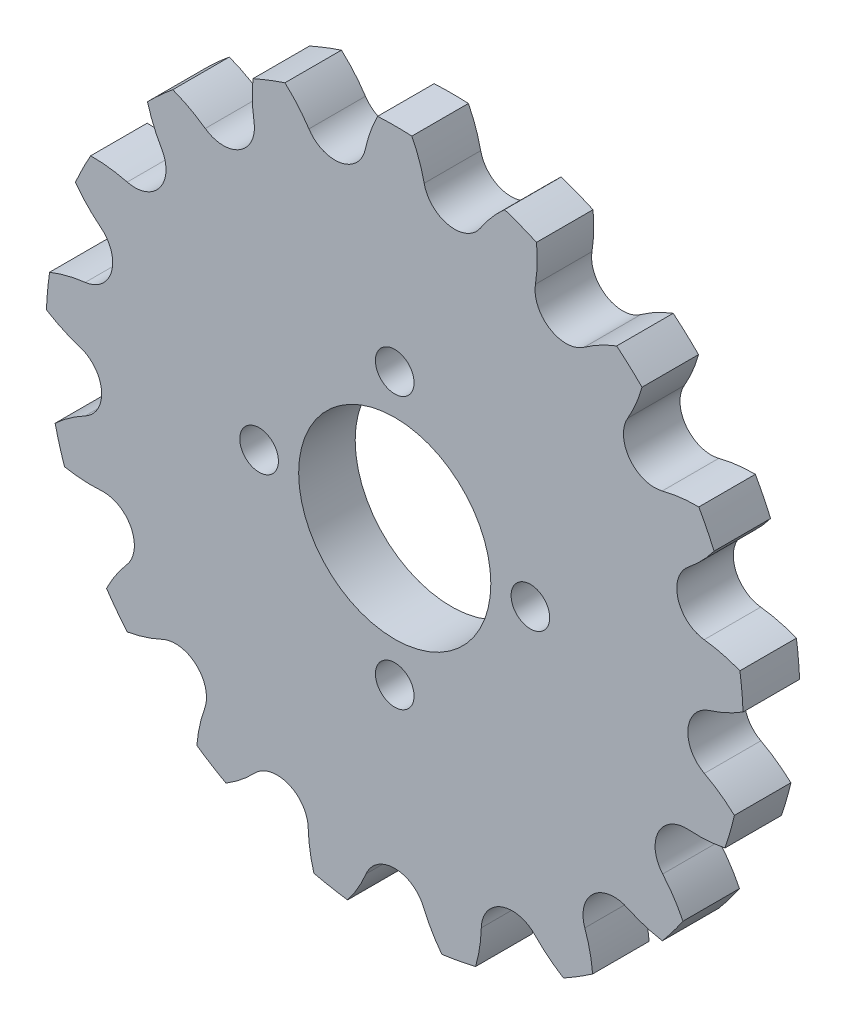
from build123d import *

# Parameters (mm, degrees)
EXTRUDE_2_DEPTH      = 3
HOLE_WIZARD_M2_5_1_D = 2.05
SKETCH_4_R           = 5.1
CUT_EXTRUDE_1_DEPTH  = 10


with BuildPart() as part:
    # 草图1 → 凸台-拉伸2 (new body)
    with BuildSketch(Plane.XY):
        with BuildLine():
            ThreePointArc((-11.779760181, 14.271379579), (-12.466737886, 13.675360013), (-13.123601243, 13.046306581))
            ThreePointArc((-13.123601243, 13.046306581), (-12.803108373, 12.120767872), (-12.365117817, 11.24469604))
            ThreePointArc((-12.365117817, 11.24469604), (-12.142820781, 10.31561124), (-12.473009262, 9.419179367))
            ThreePointArc((-12.473009262, 9.419179367), (-13.244860059, 8.856275392), (-14.199312115, 8.815830257))
            ThreePointArc((-14.199312115, 8.815830257), (-15.161802274, 8.997352368), (-16.139716175, 9.052324938))
            ThreePointArc((-16.139716175, 9.052324938), (-16.564996707, 8.248388274), (-16.950263236, 7.424527004))
            ThreePointArc((-16.950263236, 7.424527004), (-16.317069389, 6.677263239), (-15.592181711, 6.018571022))
            ThreePointArc((-15.592181711, 6.018571022), (-15.049271757, 5.2325282), (-15.033334803, 4.277352535))
            ThreePointArc((-15.033334803, 4.277352535), (-15.549719866, 3.473635543), (-16.425109435, 3.091133726))
            ThreePointArc((-16.425109435, 3.091133726), (-17.388178129, 2.912706505), (-18.319914067, 2.610703653))
            ThreePointArc((-18.319914067, 2.610703653), (-18.426060932, 1.707425992), (-18.487698254, 0.800023914))
            ThreePointArc((-18.487698254, 0.800023914), (-17.627319769, 0.331957205), (-16.713435066, -0.020395362))
            ThreePointArc((-16.713435066, -0.020395362), (-15.923235192, -0.557236769), (-15.563325175, -1.442154458))
            ThreePointArc((-15.563325175, -1.442154458), (-15.754503841, -2.378138035), (-16.432604711, -3.051037542))
            ThreePointArc((-16.432604711, -3.051037542), (-17.266184176, -3.565316511), (-18.02590605, -4.183507626))
            ThreePointArc((-18.02590605, -4.183507626), (-17.798583527, -5.064133631), (-17.528267179, -5.932526839))
            ThreePointArc((-17.528267179, -5.932526839), (-16.556902937, -6.058181489), (-15.577446402, -6.056607239))
            ThreePointArc((-15.577446402, -6.056607239), (-14.64667748, -6.271743824), (-13.991402244, -6.966890501))
            ThreePointArc((-13.991402244, -6.966890501), (-13.831554774, -7.908730892), (-14.220785664, -8.781149285))
            ThreePointArc((-14.220785664, -8.781149285), (-14.812296375, -9.561823776), (-15.297399536, -10.412713019))
            ThreePointArc((-15.297399536, -10.412713019), (-14.767308791, -11.151753946), (-14.201546494, -11.863856968))
            ThreePointArc((-14.201546494, -11.863856968), (-13.250384619, -11.630129203), (-12.337637284, -11.274840748))
            ThreePointArc((-12.337637284, -11.274840748), (-11.392004814, -11.139217123), (-10.52986291, -11.550709376))
            ThreePointArc((-10.52986291, -11.550709376), (-10.040577591, -12.371205819), (-10.088370713, -13.325318158))
            ThreePointArc((-10.088370713, -13.325318158), (-10.357925871, -14.266953756), (-10.502894449, -15.23562382))
            ThreePointArc((-10.502894449, -15.23562382), (-9.741627174, -15.733268097), (-8.956828262, -16.192907475))
            ThreePointArc((-8.956828262, -16.192907475), (-8.154328435, -15.631363523), (-7.431561886, -14.970344538))
            ThreePointArc((-7.431561886, -14.970344538), (-6.598778773, -14.502277424), (-5.646207243, -14.574540946))
            ThreePointArc((-5.646207243, -14.574540946), (-4.893564768, -15.162880849), (-4.593465396, -16.069828976))
            ThreePointArc((-4.593465396, -16.069828976), (-4.504660083, -17.045252575), (-4.289915268, -18.000879201))
            ThreePointArc((-4.289915268, -18.000879201), (-3.400284827, -18.18991721), (-2.502440741, -18.335016099))
            ThreePointArc((-2.502440741, -18.335016099), (-1.956985011, -17.521495584), (-1.521812876, -16.644020345))
            ThreePointArc((-1.521812876, -16.644020345), (-0.914351093, -15.9067248), (0, -15.63))
            ThreePointArc((0, -15.63), (0.914351093, -15.9067248), (1.521812876, -16.644020345))
            ThreePointArc((1.521812876, -16.644020345), (1.956985011, -17.521495584), (2.502440741, -18.335016099))
            ThreePointArc((2.502440741, -18.335016099), (3.400284827, -18.18991721), (4.289915268, -18.000879201))
            ThreePointArc((4.289915268, -18.000879201), (4.504660083, -17.045252575), (4.593465396, -16.069828976))
            ThreePointArc((4.593465396, -16.069828976), (4.893564768, -15.162880849), (5.646207243, -14.574540946))
            ThreePointArc((5.646207243, -14.574540946), (6.598778773, -14.502277424), (7.431561886, -14.970344538))
            ThreePointArc((7.431561886, -14.970344538), (8.154328435, -15.631363523), (8.956828262, -16.192907475))
            ThreePointArc((8.956828262, -16.192907475), (9.741627174, -15.733268097), (10.502894449, -15.23562382))
            ThreePointArc((10.502894449, -15.23562382), (10.357925871, -14.266953756), (10.088370713, -13.325318158))
            ThreePointArc((10.088370713, -13.325318158), (10.040577591, -12.371205819), (10.52986291, -11.550709376))
            ThreePointArc((10.52986291, -11.550709376), (11.392004814, -11.139217123), (12.337637284, -11.274840748))
            ThreePointArc((12.337637284, -11.274840748), (13.250384619, -11.630129203), (14.201546494, -11.863856968))
            ThreePointArc((14.201546494, -11.863856968), (14.767308791, -11.151753946), (15.297399536, -10.412713019))
            ThreePointArc((15.297399536, -10.412713019), (14.812296375, -9.561823776), (14.220785664, -8.781149285))
            ThreePointArc((14.220785664, -8.781149285), (13.831554774, -7.908730892), (13.991402244, -6.966890501))
            ThreePointArc((13.991402244, -6.966890501), (14.64667748, -6.271743824), (15.577446402, -6.056607239))
            ThreePointArc((15.577446402, -6.056607239), (16.556902937, -6.058181489), (17.528267179, -5.932526839))
            ThreePointArc((17.528267179, -5.932526839), (17.798583527, -5.064133631), (18.02590605, -4.183507626))
            ThreePointArc((18.02590605, -4.183507626), (17.266184176, -3.565316511), (16.432604711, -3.051037542))
            ThreePointArc((16.432604711, -3.051037542), (15.754503841, -2.378138035), (15.563325175, -1.442154458))
            ThreePointArc((15.563325175, -1.442154458), (15.923235192, -0.557236769), (16.713435066, -0.020395362))
            ThreePointArc((16.713435066, -0.020395362), (17.627319769, 0.331957205), (18.487698254, 0.800023914))
            ThreePointArc((18.487698254, 0.800023914), (18.426060932, 1.707425992), (18.319914067, 2.610703653))
            ThreePointArc((18.319914067, 2.610703653), (17.388178129, 2.912706505), (16.425109435, 3.091133726))
            ThreePointArc((16.425109435, 3.091133726), (15.549719866, 3.473635543), (15.033334803, 4.277352535))
            ThreePointArc((15.033334803, 4.277352535), (15.049271757, 5.2325282), (15.592181711, 6.018571022))
            ThreePointArc((15.592181711, 6.018571022), (16.317069389, 6.677263239), (16.950263236, 7.424527004))
            ThreePointArc((16.950263236, 7.424527004), (16.564996707, 8.248388274), (16.139716175, 9.052324938))
            ThreePointArc((16.139716175, 9.052324938), (15.161802274, 8.997352368), (14.199312115, 8.815830257))
            ThreePointArc((14.199312115, 8.815830257), (13.244860059, 8.856275392), (12.473009262, 9.419179367))
            ThreePointArc((12.473009262, 9.419179367), (12.142820781, 10.31561124), (12.365117817, 11.24469604))
            ThreePointArc((12.365117817, 11.24469604), (12.803108373, 12.120767872), (13.123601243, 13.046306581))
            ThreePointArc((13.123601243, 13.046306581), (12.466737886, 13.675360013), (11.779760181, 14.271379579))
            ThreePointArc((11.779760181, 14.271379579), (10.887741008, 13.866855937), (10.055819013, 13.349900061))
            ThreePointArc((10.055819013, 13.349900061), (9.151208508, 13.042826175), (8.228134706, 13.288893831))
            ThreePointArc((8.228134706, 13.288893831), (7.596414573, 14.005513822), (7.468076245, 14.952162548))
            ThreePointArc((7.468076245, 14.952162548), (7.560016626, 15.927295641), (7.524524182, 16.906110163))
            ThreePointArc((7.524524182, 16.906110163), (6.684777033, 17.255398605), (5.8288823, 17.563005328))
            ThreePointArc((5.8288823, 17.563005328), (5.143229987, 16.863563773), (4.554231832, 16.080991887))
            ThreePointArc((4.554231832, 16.080991887), (3.821635541, 15.46787101), (2.872004963, 15.363869548))
            ThreePointArc((2.872004963, 15.363869548), (2.024070484, 15.803894155), (1.562429593, 16.640256651))
            ThreePointArc((1.562429593, 16.640256651), (1.295902743, 17.582753877), (0.909218435, 18.482649887))
            ThreePointArc((0.909218435, 18.482649887), (0, 18.505), (-0.909218435, 18.482649887))
            ThreePointArc((-0.909218435, 18.482649887), (-1.295902743, 17.582753877), (-1.562429593, 16.640256651))
            ThreePointArc((-1.562429593, 16.640256651), (-2.024070484, 15.803894155), (-2.872004963, 15.363869548))
            ThreePointArc((-2.872004963, 15.363869548), (-3.821635541, 15.46787101), (-4.554231832, 16.080991887))
            ThreePointArc((-4.554231832, 16.080991887), (-5.143229987, 16.863563773), (-5.8288823, 17.563005328))
            ThreePointArc((-5.8288823, 17.563005328), (-6.684777033, 17.255398605), (-7.524524182, 16.906110163))
            ThreePointArc((-7.524524182, 16.906110163), (-7.560016626, 15.927295641), (-7.468076245, 14.952162548))
            ThreePointArc((-7.468076245, 14.952162548), (-7.596414573, 14.005513822), (-8.228134706, 13.288893831))
            ThreePointArc((-8.228134706, 13.288893831), (-9.151208508, 13.042826175), (-10.055819013, 13.349900061))
            ThreePointArc((-10.055819013, 13.349900061), (-10.887741008, 13.866855937), (-11.779760181, 14.271379579))
        make_face()
    extrude(amount=EXTRUDE_2_DEPTH)

    # M2.5 螺纹孔1 (through all)
    with Locations(Plane(origin=(0, 7.2, 3), x_dir=(1, 0, 0), z_dir=(0, 0, 1))):
        with Locations((0, 0), (7.2, -7.2), (0, -14.4), (-7.2, -7.2)):
            Hole(HOLE_WIZARD_M2_5_1_D / 2)

    # 草图4 → 切除-拉伸1 (cut)
    with BuildSketch(Plane(origin=(0, 0, 0), x_dir=(-1, 0, 0), z_dir=(0, 0, -1))):
        Circle(SKETCH_4_R)
    extrude(amount=-CUT_EXTRUDE_1_DEPTH, mode=Mode.SUBTRACT)


solid = part.part
